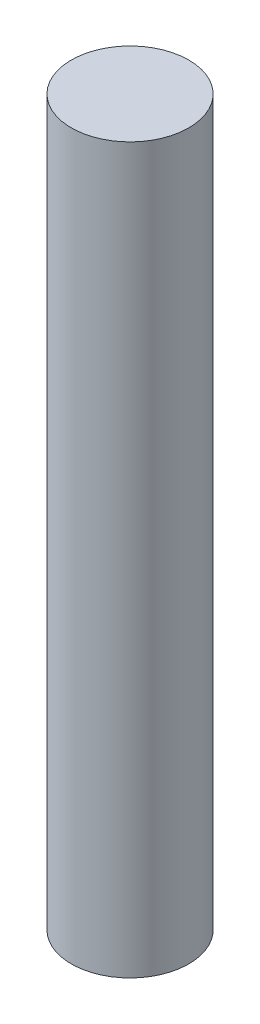
from build123d import *

# Parameters (mm, degrees)
CROQUIS1_R              = 4.7625
SALIENTE_EXTRUIR1_DEPTH = 58.68


with BuildPart() as part:
    # Croquis1 → Saliente-Extruir1 (new body)
    with BuildSketch(Plane(origin=(0, 0, 0), x_dir=(1, 0, 0), z_dir=(0, 1, 0))):
        with Locations(Location((0, 0, 0), (0, 0, 90))):
            Circle(CROQUIS1_R)
    extrude(amount=SALIENTE_EXTRUIR1_DEPTH)


solid = part.part
